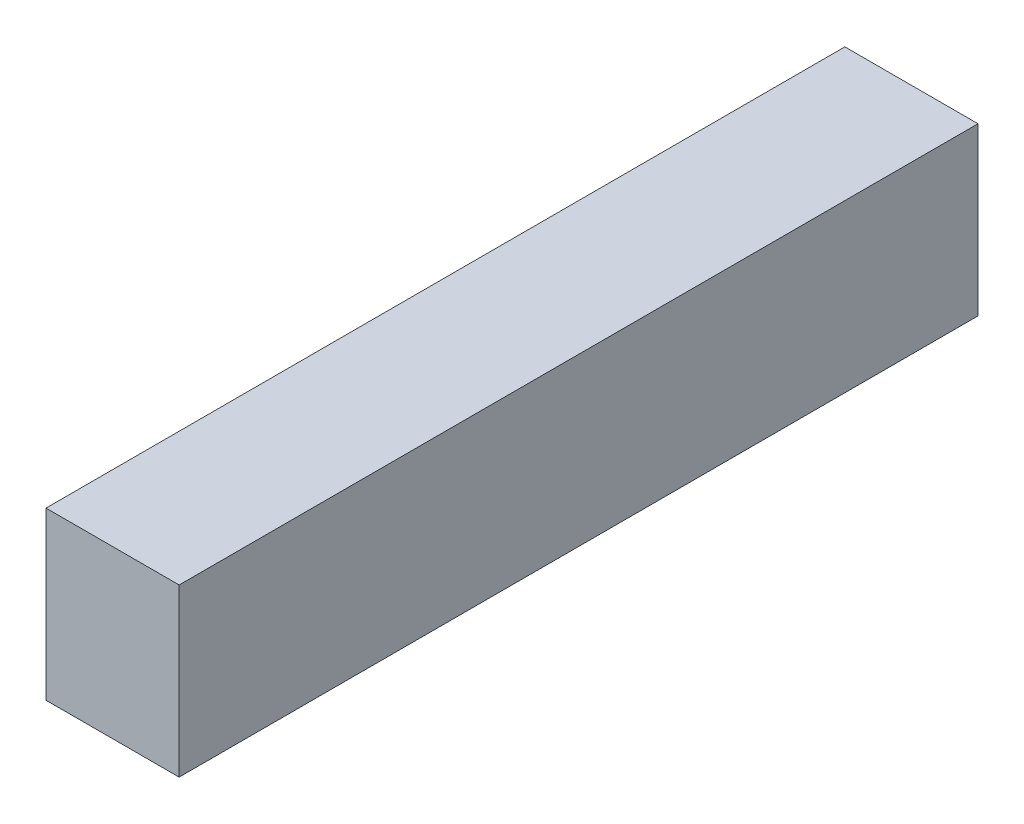
from build123d import *

# Parameters (mm, degrees)
SKETCH1_W           = 8
SKETCH1_H           = 48
BOSS_EXTRUDE1_DEPTH = 10


with BuildPart() as part:
    # Sketch1 → Boss-Extrude1 (new body)
    with BuildSketch(Plane(origin=(0, 0, 0), x_dir=(1, 0, 0), z_dir=(0, 1, 0))):
        Rectangle(SKETCH1_W, SKETCH1_H)
    extrude(amount=-BOSS_EXTRUDE1_DEPTH)


solid = part.part
